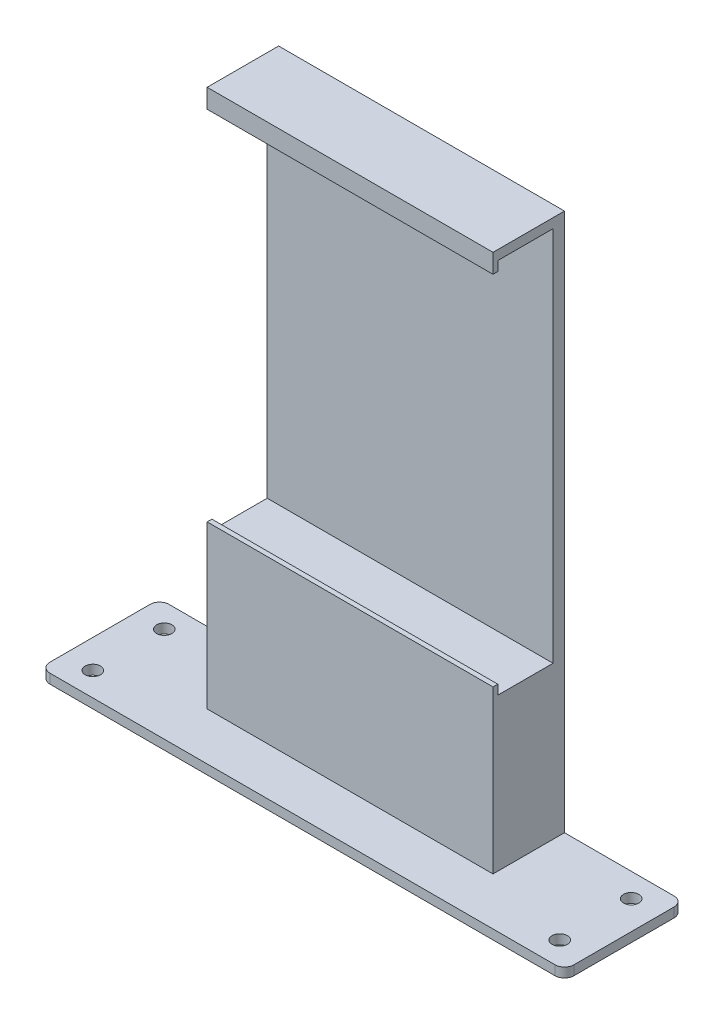
from build123d import *

# Parameters (mm, degrees)
SKETCH_1_W          = 110
SKETCH_1_H          = 25
SKETCH_1_R          = 1.6
EXTRUDE_1_DEPTH     = 2
SKETCH_2_W          = 60
SKETCH_2_H          = 15
EXTRUDE_2_DEPTH     = 113
CUT_EXTRUDE_1_DEPTH = 60
FILLET_1_R          = 2
FILLET_2_R          = 2
FILLET_3_R          = 2
FILLET_4_R          = 2


with BuildPart() as part:
    # 草图1 → 凸台-拉伸1 (new body)
    with BuildSketch(Plane(origin=(0, 0, 0), x_dir=(1, 0, 0), z_dir=(0, 1, 0))):
        Rectangle(SKETCH_1_W, SKETCH_1_H)
        with Locations(Location((-49, 7.5, 0), (0, 0, 270))):
            Circle(SKETCH_1_R, mode=Mode.SUBTRACT)
        with Locations(Location((49, 7.5, 0), (0, 0, 90))):
            Circle(SKETCH_1_R, mode=Mode.SUBTRACT)
        with Locations(Location((49, -7.5, 0), (0, 0, 270))):
            Circle(SKETCH_1_R, mode=Mode.SUBTRACT)
        with Locations(Location((-49, -7.5, 0), (0, 0, 90))):
            Circle(SKETCH_1_R, mode=Mode.SUBTRACT)
    extrude(amount=EXTRUDE_1_DEPTH)

    # 草图2 → 凸台-拉伸2 (add)
    with BuildSketch(Plane(origin=(0, 115, 0), x_dir=(1, 0, 0), z_dir=(0, 1, 0))):
        with Locations((0, 5)):
            Rectangle(SKETCH_2_W, SKETCH_2_H)
    extrude(amount=-EXTRUDE_2_DEPTH)

    # 草图3 → 切除-拉伸1 (cut)
    with BuildSketch(Plane(origin=(30, 0, 0), x_dir=(0, 0, -1), z_dir=(1, 0, 0))):
        Polygon((-2.5, 36), (-1.5, 36), (-1.5, 34), (10.1, 34), (10.1, 113), (-1.5, 113), (-1.5, 111), (-2.5, 111), align=None)
    extrude(amount=-CUT_EXTRUDE_1_DEPTH, mode=Mode.SUBTRACT)

    # 圆角1
    fillet_1_edges = [part.edges().sort_by_distance(p)[0] for p in [
        (55, 1, 12.5),
    ]]
    fillet(fillet_1_edges, radius=FILLET_1_R)

    # 圆角2
    fillet_2_edges = [part.edges().sort_by_distance(p)[0] for p in [
        (55, 1, -12.5),
    ]]
    fillet(fillet_2_edges, radius=FILLET_2_R)

    # 圆角3
    fillet_3_edges = [part.edges().sort_by_distance(p)[0] for p in [
        (-55, 1, -12.5),
    ]]
    fillet(fillet_3_edges, radius=FILLET_3_R)

    # 圆角4
    fillet_4_edges = [part.edges().sort_by_distance(p)[0] for p in [
        (-55, 1, 12.5),
    ]]
    fillet(fillet_4_edges, radius=FILLET_4_R)


solid = part.part
